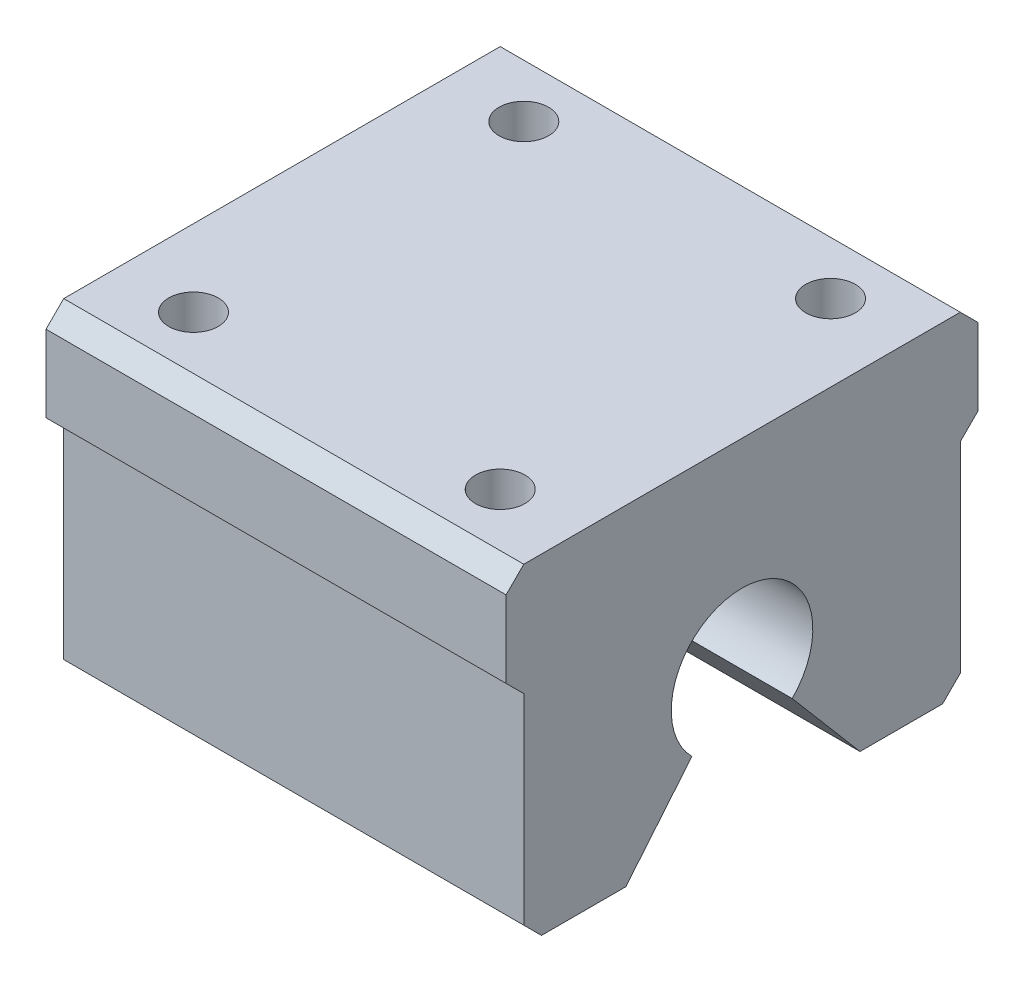
from build123d import *

# Parameters (mm, degrees)
ESQUISSE1_W               = 39
ESQUISSE1_H               = 40
EXTRUSION1_DEPTH          = 9.5
CHANFREIN1_SIZE           = 1.5
ESQUISSE5_W               = 39
ESQUISSE5_H               = 37
EXTRUSION2_DEPTH          = 18.5
CHANFREIN2_SIZE           = 1.5
ESQUISSE6_R               = 2.75
EXTRUSION3_DEPTH          = 5
CHANFREIN3_SIZE           = 1
TROU_TARAUD_M5X0_81_D     = 4.2
TROU_TARAUD_M5X0_81_DEPTH = 12.4
TROU_TARAUD_M5X0_81_TIP   = 1.2618073
EXTRUSION4_DEPTH          = 52.171504892


with BuildPart() as part:
    # Esquisse1 → Extrusion1 (new body)
    with BuildSketch(Plane(origin=(0, 0, 0), x_dir=(1, 0, 0), z_dir=(0, 1, 0))):
        with Locations((6.550185129, -7.482229039)):
            Rectangle(ESQUISSE1_W, ESQUISSE1_H)
    extrude(amount=EXTRUSION1_DEPTH)

    # Chanfrein1
    chanfrein1_edges = [part.edges().sort_by_distance(p)[0] for p in [
        (6.550185129, 9.5, -12.517770961),
        (6.550185129, 0, -12.517770961),
        (6.550185129, 0, 27.482229039),
        (6.550185129, 9.5, 27.482229039),
    ]]
    chamfer(chanfrein1_edges, length=CHANFREIN1_SIZE)

    # Esquisse5 → Extrusion2 (add)
    with BuildSketch(Plane.XZ):
        with Locations((6.550185129, 7.482229039)):
            Rectangle(ESQUISSE5_W, ESQUISSE5_H)
    extrude(amount=EXTRUSION2_DEPTH)

    # Chanfrein2
    chanfrein2_edges = [part.edges().sort_by_distance(p)[0] for p in [
        (6.550185129, -18.5, -11.017770961),
        (6.550185129, -18.5, 25.982229039),
    ]]
    chamfer(chanfrein2_edges, length=CHANFREIN2_SIZE)

    # Esquisse6 → Extrusion3 (cut)
    with BuildSketch(Plane(origin=(0, 0, -11.017770961), x_dir=(-1, 0, 0), z_dir=(0, 0, -1))):
        with Locations((-6.050185129, -9)):
            Circle(ESQUISSE6_R)
    extrude(amount=-EXTRUSION3_DEPTH, mode=Mode.SUBTRACT)

    # Chanfrein3
    chanfrein3_edges = [part.edges().sort_by_distance(p)[0] for p in [
        (8.800185129, -9, -11.017770961),
    ]]
    chamfer(chanfrein3_edges, length=CHANFREIN3_SIZE)

    # Trou taraudé M5x0.81
    with Locations(Plane(origin=(-6.449814871, 9.5, -6.517770961), x_dir=(0, 0, 1), z_dir=(0, 1, 0))):
        with Locations((0, 0), (0, 26), (28, 26), (28, 0)):
            Hole(TROU_TARAUD_M5X0_81_D / 2, depth=TROU_TARAUD_M5X0_81_DEPTH)
            with Locations((0, 0, -(TROU_TARAUD_M5X0_81_DEPTH + TROU_TARAUD_M5X0_81_TIP / 2))):  # 118° drill point
                Cone(0, TROU_TARAUD_M5X0_81_D / 2, TROU_TARAUD_M5X0_81_TIP, mode=Mode.SUBTRACT)

    # Esquisse8 → Extrusion4 (cut, through all)
    with BuildSketch(Plane.ZY.offset(12.949814871)):
        with BuildLine():
            Line((3.232229039, -11.735268587), (-2.517770961, -18.5))
            Line((-2.517770961, -18.5), (17.335579002, -18.5))
            Line((17.335579002, -18.5), (11.732229039, -11.735268587))
            ThreePointArc((11.732229039, -11.735268587), (7.482229039, -1.5), (3.232229039, -11.735268587))
        make_face()
    extrude(amount=-EXTRUSION4_DEPTH, mode=Mode.SUBTRACT)


solid = part.part
